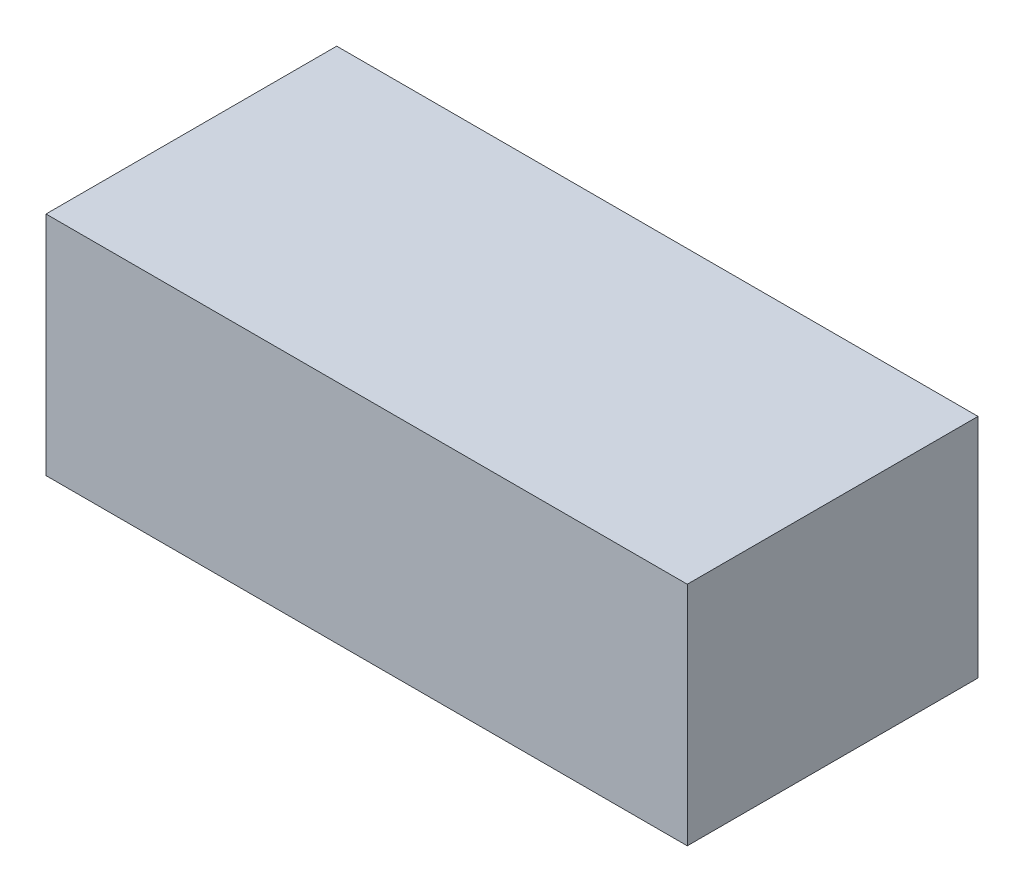
from build123d import *

# Parameters (mm, degrees)
SKETCH2_W     = 75
SKETCH2_H     = 34
BATTERY_DEPTH = 26.5


with BuildPart() as part:
    # Sketch2 → battery (new body)
    with BuildSketch(Plane(origin=(0, 0, 0), x_dir=(1, 0, 0), z_dir=(0, 1, 0))):
        with Locations((11.831125828, -1.463576159)):
            Rectangle(SKETCH2_W, SKETCH2_H)
    extrude(amount=BATTERY_DEPTH)


solid = part.part
